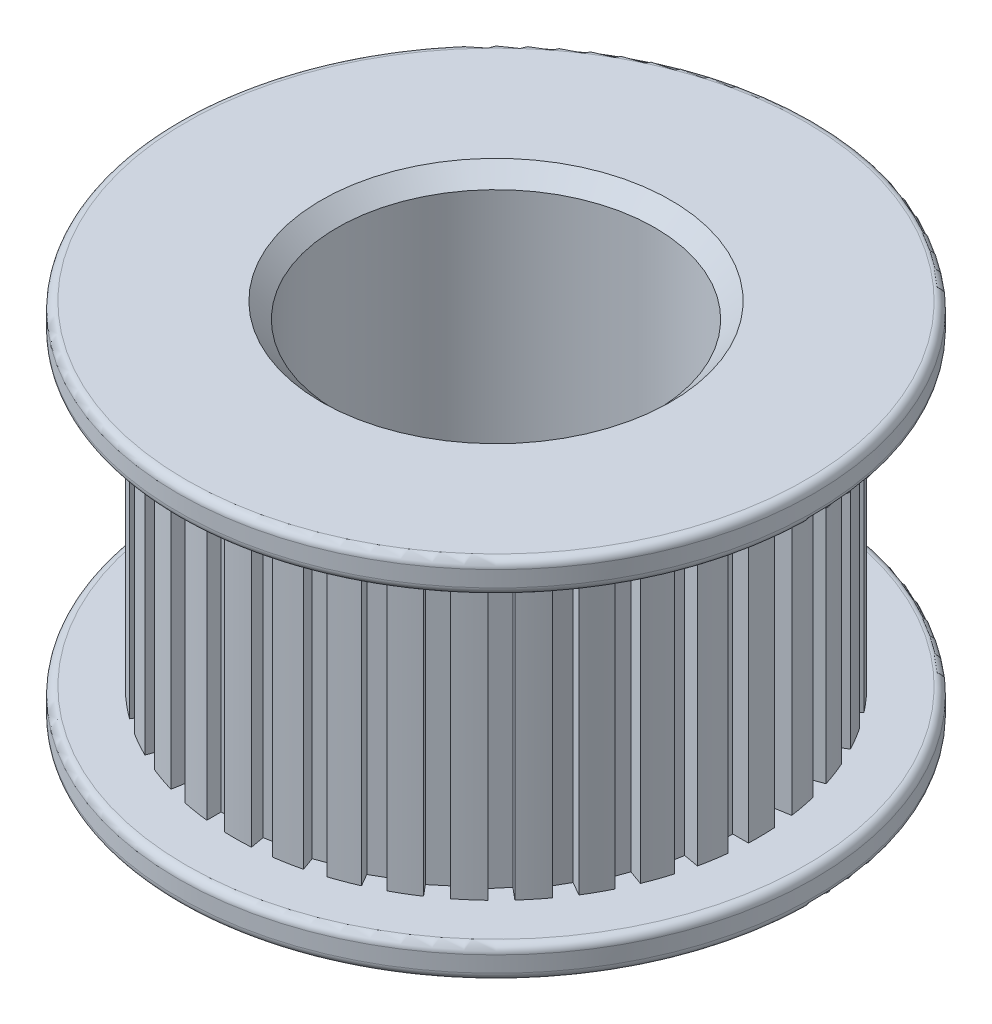
from build123d import *

# Parameters (mm, degrees)
CHAMFER1_SIZE      = 25.4
FILLET1_R          = 12.7
SKETCH3_W          = 30.48
SKETCH3_H          = 30.48
CUT_EXTRUDE1_DEPTH = 482.6
CIRPATTERN1_COUNT  = 36
FILLET2_R          = 12.7


with BuildPart() as part:
    # Sketch1 → Revolve1 (revolve)
    with BuildSketch(Plane.XY, mode=Mode.PRIVATE) as revolve1_sk:
        Polygon((254, 0), (508, 0), (508, 50.8), (419.1, 50.8), (419.1, 533.4), (508, 533.4), (508, 584.2), (254, 584.2), align=None)
    revolve(revolve1_sk.sketch.rotate(Axis((0, 0, 0), (0, 1, 0)), 90), axis=Axis((0, 0, 0), (0, 1, 0)))

    # Chamfer1
    chamfer1_edges = [part.edges().sort_by_distance(p)[0] for p in [
        (0, 584.2, 254),
    ]]
    chamfer(chamfer1_edges, length=CHAMFER1_SIZE)

    # Fillet1
    fillet1_edges = [part.edges().sort_by_distance(p)[0] for p in [
        (0, 584.2, 508),
        (0, 533.4, 508),
        (0, 50.8, 508),
        (0, 0, 508),
    ]]
    fillet(fillet1_edges, radius=FILLET1_R)

    # Sketch3 → Cut-Extrude1 (cut)
    with BuildSketch(Plane(origin=(0, 50.8, 0), x_dir=(1, 0, 0), z_dir=(0, 1, 0))):
        with Locations((30.48, 408.94)):
            Rectangle(SKETCH3_W, SKETCH3_H)
    cut_extrude1 = extrude(amount=CUT_EXTRUDE1_DEPTH, mode=Mode.SUBTRACT)

    # CirPattern1: Cut-Extrude1 ×36 about axis
    cirpattern1_axis = Axis((0, 0, 0), (0, 1, 0))
    for i in range(1, CIRPATTERN1_COUNT):
        add(cut_extrude1.rotate(cirpattern1_axis, i * 360 / CIRPATTERN1_COUNT), mode=Mode.SUBTRACT)

    # Fillet2
    fillet2_edges = [part.edges().sort_by_distance(p)[0] for p in [
        (0, 0, 254),
    ]]
    fillet(fillet2_edges, radius=FILLET2_R)


solid = part.part
